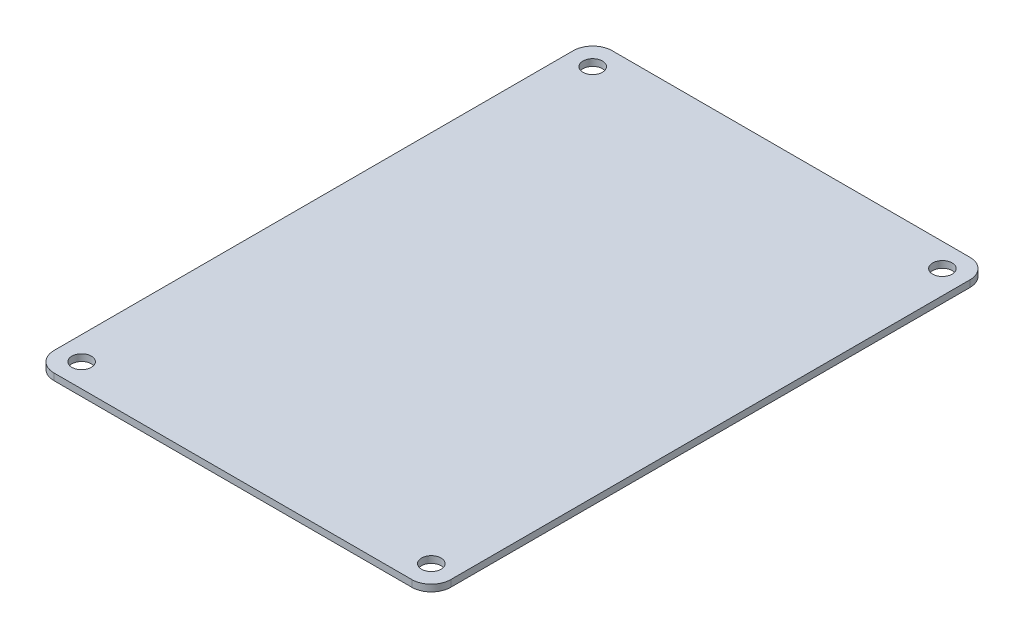
from build123d import *

# Parameters (mm, degrees)
SKETCH2_R           = 1.45
BOSS_EXTRUDE1_DEPTH = 1


with BuildPart() as part:
    # Sketch2 → Boss-Extrude1 (new body)
    with BuildSketch(Plane(origin=(0, 0, 0), x_dir=(1, 0, 0), z_dir=(0, 1, 0))):
        with BuildLine():
            Line((-29.5, 38.6), (-29.5, -38.6))
            ThreePointArc((-29.5, -38.6), (-28.650609665, -40.650609665), (-26.6, -41.5))
            Line((-26.6, -41.5), (26.6, -41.5))
            ThreePointArc((26.6, -41.5), (28.650609665, -40.650609665), (29.5, -38.6))
            Line((29.5, -38.6), (29.5, 38.6))
            ThreePointArc((29.5, 38.6), (28.650609665, 40.650609665), (26.6, 41.5))
            Line((26.6, 41.5), (-26.6, 41.5))
            ThreePointArc((-26.6, 41.5), (-28.650609665, 40.650609665), (-29.5, 38.6))
        make_face()
        with Locations(Location((-26, 38, 0), (0, 0, 270))):
            Circle(SKETCH2_R, mode=Mode.SUBTRACT)
        with Locations(Location((26, 38, 0), (0, 0, 270))):
            Circle(SKETCH2_R, mode=Mode.SUBTRACT)
        with Locations(Location((26, -38, 0), (0, 0, 270))):
            Circle(SKETCH2_R, mode=Mode.SUBTRACT)
        with Locations(Location((-26, -38, 0), (0, 0, 270))):
            Circle(SKETCH2_R, mode=Mode.SUBTRACT)
    extrude(amount=BOSS_EXTRUDE1_DEPTH)


solid = part.part
